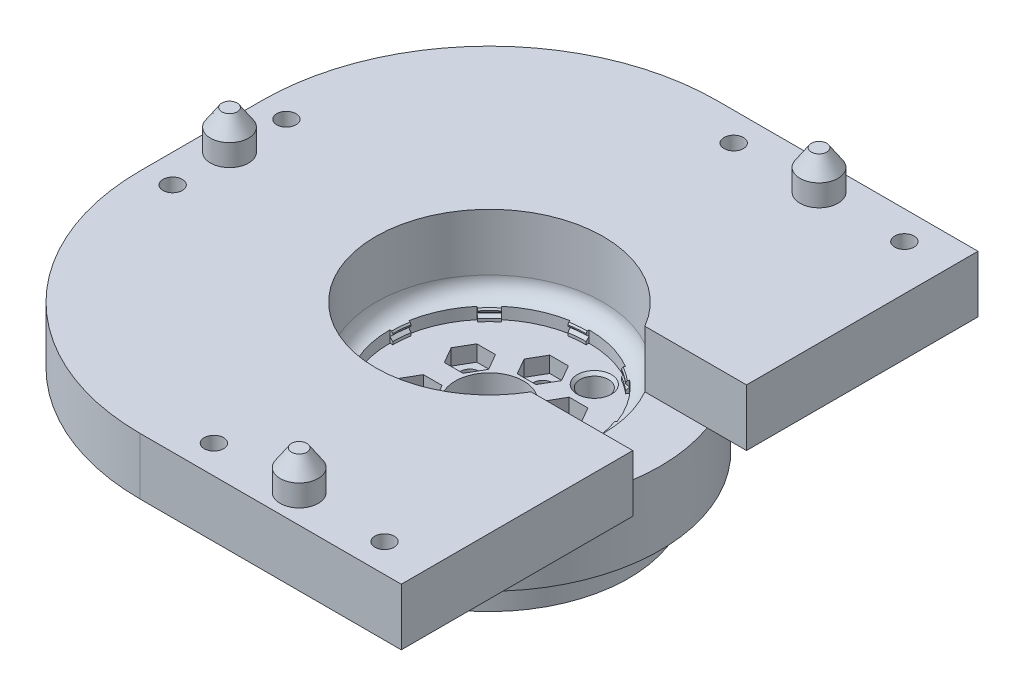
from build123d import *

# Parameters (mm, degrees)
CUT_EXTRUDE1_REACH            = 47
CUT_EXTRUDE1_END_MAJOR_RADIUS = 17
CUT_EXTRUDE1_END_MINOR_RADIUS = 3
CIRPATTERN1_COUNT             = 9
SKETCH3_R                     = 2.5
SKETCH3_R_2                   = 1.7
CUT_EXTRUDE2_DEPTH            = 2.8
SKETCH3_2_R                   = 1.7
CUT_EXTRUDE3_DEPTH            = 46
SKETCH3_4_R                   = 2.5
CUT_EXTRUDE4_DEPTH            = 5
CHAMFER1_SIZE                 = 0.5
CUT_EXTRUDE5_DEPTH            = 10
BOSS_EXTRUDE1_DEPTH           = 10
SKETCH10_R                    = 1.7
CUT_EXTRUDE6_DEPTH            = 78.723741547
CUT_EXTRUDE7_DEPTH            = 3


with BuildPart() as part:
    # Sketch1 → Revolve1 (revolve)
    with BuildSketch(Plane.XY, mode=Mode.PRIVATE) as revolve1_sk:
        with BuildLine():
            Line((6, 15), (6, 0))
            Line((6, 0), (19.8, 0))
            Line((19.8, 0), (19.8, 0.2))
            Line((19.8, 0.2), (24.5, 0.2))
            Line((24.5, 0.2), (24.5, 7.2))
            Line((24.5, 7.2), (30, 7.2))
            Line((30, 7.2), (30, 30))
            Line((30, 30), (20, 30))
            Line((20, 30), (20, 20))
            ThreePointArc((20, 20), (19.19089023, 17.950609847), (17.2, 17.006674091))
            Line((17.2, 17.006674091), (17, 16.7))
            Line((17, 16.7), (17, 16.5))
            Line((17, 16.5), (17.5, 16))
            Line((17.5, 16), (17, 15.5))
            Line((17, 15.5), (17, 15))
            Line((17, 15), (6, 15))
        make_face()
    revolve(revolve1_sk.sketch.rotate(Axis((0, -743.646827703, 0), (0, 1, 0)), 90), axis=Axis((0, -743.646827703, 0), (0, 1, 0)))

    # Cut-Extrude1: up to this torus (the profile starts outside it)
    cut_extrude1_end = Plane(origin=(0, 20, 0), z_dir=(0, -1, 0)) * Torus(CUT_EXTRUDE1_END_MAJOR_RADIUS, CUT_EXTRUDE1_END_MINOR_RADIUS, mode=Mode.PRIVATE)
    # Sketch2 → Cut-Extrude1 (cut, up to the surface)
    with BuildSketch(Plane(origin=(0, 15, 0), x_dir=(1, 0, 0), z_dir=(0, 1, 0)), mode=Mode.PRIVATE) as cut_extrude1_sk1:
        with BuildLine():
            Line((8.5, 14.722431864), (8.75, 15.155444566))
            ThreePointArc((8.75, 15.155444566), (4.529333289, 16.90370196), (0, 17.5))
            Line((0, 17.5), (0, 17))
            ThreePointArc((0, 17), (4.399923767, 16.420739047), (8.5, 14.722431864))
        make_face()
    cut_extrude1_tool1 = extrude(cut_extrude1_sk1.sketch, amount=CUT_EXTRUDE1_REACH, mode=Mode.PRIVATE) - cut_extrude1_end
    cut_extrude1 = cut_extrude1_tool1.solids().sort_by_distance((4.414112, 15, -16.47369))[0]
    add(cut_extrude1, mode=Mode.SUBTRACT)

    # CirPattern1: Cut-Extrude1 ×9 about axis
    cirpattern1_axis = Axis((0, 0, 0), (0, 1, 0))
    for i in range(1, CIRPATTERN1_COUNT):
        add(cut_extrude1.rotate(cirpattern1_axis, i * 360 / CIRPATTERN1_COUNT), mode=Mode.SUBTRACT)

    # Sketch3 → Cut-Extrude2 (cut)
    # profile 1 of 8: a face of its own
    with BuildSketch(Plane(origin=(0, 15, 0), x_dir=(1, 0, 0), z_dir=(0, 1, 0))):
        with Locations(Location((6.75, 11.691342951, 0), (0, 0, 270))):
            Circle(SKETCH3_R)
    # profile 2 of 8: a face of its own
    with BuildSketch(Plane(origin=(0, 15, 0), x_dir=(1, 0, 0), z_dir=(0, 1, 0))):
        with Locations(Location((-6.75, -11.691342951, 0), (0, 0, 270))):
            Circle(SKETCH3_R)
    # profile 3 of 8: a face of its own
    with BuildSketch(Plane(origin=(0, 15, 0), x_dir=(1, 0, 0), z_dir=(0, 1, 0))):
        Polygon((9.773096682, 1.8425), (11.418544949, 4.6925), (9.773096682, 7.5425), (6.482200147, 7.5425), (4.83675188, 4.6925), (6.482200147, 1.8425), align=None)
        with Locations(Location((8.127648415, 4.6925, 0), (0, 0, 270))):
            Circle(SKETCH3_R_2, mode=Mode.SUBTRACT)
    # profile 4 of 8: a face of its own
    with BuildSketch(Plane(origin=(0, 15, 0), x_dir=(1, 0, 0), z_dir=(0, 1, 0))):
        Polygon((3.290896534, 9.385), (1.645448267, 12.235), (-1.645448267, 12.235), (-3.290896534, 9.385), (-1.645448267, 6.535), (1.645448267, 6.535), align=None)
        with Locations(Location((0, 9.385, 0), (0, 0, 270))):
            Circle(SKETCH3_R_2, mode=Mode.SUBTRACT)
    # profile 5 of 8: a face of its own
    with BuildSketch(Plane(origin=(0, 15, 0), x_dir=(1, 0, 0), z_dir=(0, 1, 0))):
        Polygon((6.482200147, -7.5425), (9.773096682, -7.5425), (11.418544949, -4.6925), (9.773096682, -1.8425), (6.482200147, -1.8425), (4.83675188, -4.6925), align=None)
        with Locations(Location((8.127648415, -4.6925, 0), (0, 0, 270))):
            Circle(SKETCH3_R_2, mode=Mode.SUBTRACT)
    # profile 6 of 8: a face of its own
    with BuildSketch(Plane(origin=(0, 15, 0), x_dir=(1, 0, 0), z_dir=(0, 1, 0))):
        Polygon((-3.290896534, -9.385), (-1.645448267, -12.235), (1.645448267, -12.235), (3.290896534, -9.385), (1.645448267, -6.535), (-1.645448267, -6.535), align=None)
        with Locations(Location((0, -9.385, 0), (0, 0, 270))):
            Circle(SKETCH3_R_2, mode=Mode.SUBTRACT)
    # profile 7 of 8: a face of its own
    with BuildSketch(Plane(origin=(0, 15, 0), x_dir=(1, 0, 0), z_dir=(0, 1, 0))):
        Polygon((-9.773096682, -1.8425), (-11.418544949, -4.6925), (-9.773096682, -7.5425), (-6.482200147, -7.5425), (-4.83675188, -4.6925), (-6.482200147, -1.8425), align=None)
        with Locations(Location((-8.127648415, -4.6925, 0), (0, 0, 270))):
            Circle(SKETCH3_R_2, mode=Mode.SUBTRACT)
    # profile 8 of 8: a face of its own
    with BuildSketch(Plane(origin=(0, 15, 0), x_dir=(1, 0, 0), z_dir=(0, 1, 0))):
        Polygon((-6.482200147, 7.5425), (-9.773096682, 7.5425), (-11.418544949, 4.6925), (-9.773096682, 1.8425), (-6.482200147, 1.8425), (-4.83675188, 4.6925), align=None)
        with Locations(Location((-8.127648415, 4.6925, 0), (0, 0, 270))):
            Circle(SKETCH3_R_2, mode=Mode.SUBTRACT)
    extrude(amount=-CUT_EXTRUDE2_DEPTH, mode=Mode.SUBTRACT)

    # Sketch3<2> → Cut-Extrude3 (cut, through all)
    with BuildSketch(Plane(origin=(0, 15, 0), x_dir=(1, 0, 0), z_dir=(0, 1, 0))):
        with Locations(Location((0, 9.385, 0), (0, 0, 270))):
            Circle(SKETCH3_2_R)
        with Locations(Location((8.127648415, 4.6925, 0), (0, 0, 270))):
            Circle(SKETCH3_2_R)
        with Locations(Location((8.127648415, -4.6925, 0), (0, 0, 270))):
            Circle(SKETCH3_2_R)
        with Locations(Location((0, -9.385, 0), (0, 0, 270))):
            Circle(SKETCH3_2_R)
        with Locations(Location((-8.127648415, -4.6925, 0), (0, 0, 270))):
            Circle(SKETCH3_2_R)
        with Locations(Location((-8.127648415, 4.6925, 0), (0, 0, 270))):
            Circle(SKETCH3_2_R)
    extrude(amount=-CUT_EXTRUDE3_DEPTH, mode=Mode.SUBTRACT)

    # Sketch3<4> → Cut-Extrude4 (cut)
    with BuildSketch(Plane(origin=(0, 15, 0), x_dir=(1, 0, 0), z_dir=(0, 1, 0))):
        with Locations(Location((6.75, 11.691342951, 0), (0, 0, 270))):
            Circle(SKETCH3_4_R)
        with Locations(Location((-6.75, -11.691342951, 0), (0, 0, 270))):
            Circle(SKETCH3_4_R)
    extrude(amount=-CUT_EXTRUDE4_DEPTH, mode=Mode.SUBTRACT)

    # Chamfer1
    chamfer1_edges = [part.edges().sort_by_distance(p)[0] for p in [
        (6.75, 15, -14.191342951),
        (-6.75, 15, 9.191342951),
    ]]
    chamfer(chamfer1_edges, length=CHAMFER1_SIZE)

    # Sketch6 → Cut-Extrude5 (cut)
    with BuildSketch(Plane(origin=(0, 30, 0), x_dir=(1, 0, 0), z_dir=(0, 1, 0))):
        with BuildLine():
            Line((28.284271247, 10), (17.320508076, 10))
            ThreePointArc((17.320508076, 10), (19.318516526, 5.176380902), (20, 0))
            ThreePointArc((20, 0), (19.318516526, -5.176380902), (17.320508076, -10))
            Line((17.320508076, -10), (28.284271247, -10))
            ThreePointArc((28.284271247, -10), (29.56795679, -5.073059362), (30, 0))
            ThreePointArc((30, 0), (29.56795679, 5.073059362), (28.284271247, 10))
        make_face()
    extrude(amount=-CUT_EXTRUDE5_DEPTH, mode=Mode.SUBTRACT)

    # Sketch7 → Boss-Extrude1 (add)
    with BuildSketch(Plane(origin=(0, 30, 0), x_dir=(1, 0, 0), z_dir=(0, 1, 0))):
        with BuildLine():
            Line((28.284271247, -10), (17.320508076, -10))
            ThreePointArc((17.320508076, -10), (-20, 0), (17.320508076, 10))
            Line((17.320508076, 10), (28.284271247, 10))
            ThreePointArc((28.284271247, 10), (-30, 0), (28.284271247, -10))
        make_face()
        with BuildLine():
            Line((0, -30.7), (35.2, -30.7))
            Line((35.2, -30.7), (35.2, -10))
            Line((35.2, -10), (28.284271247, -10))
            ThreePointArc((28.284271247, -10), (-30, 0), (28.284271247, 10))
            Line((28.284271247, 10), (35.2, 10))
            Line((35.2, 10), (35.2, 30.7))
            Line((35.2, 30.7), (0, 30.7))
            ThreePointArc((0, 30.7), (-30.7, 0), (0, -30.7))
        make_face()
        with BuildLine():
            Line((35.2, 50.7), (-10.7, 50.7))
            ThreePointArc((-10.7, 50.7), (-38.984271247, 38.984271247), (-50.7, 10.7))
            Line((-50.7, 10.7), (-50.7, -10.7))
            ThreePointArc((-50.7, -10.7), (-38.984271247, -38.984271247), (-10.7, -50.7))
            Line((-10.7, -50.7), (35.2, -50.7))
            Line((35.2, -50.7), (35.2, -30.7))
            Line((35.2, -30.7), (0, -30.7))
            ThreePointArc((0, -30.7), (-30.7, 0), (0, 30.7))
            Line((0, 30.7), (35.2, 30.7))
            Line((35.2, 30.7), (35.2, 50.7))
        make_face()
    extrude(amount=-BOSS_EXTRUDE1_DEPTH)

    # Sketch9 → Revolve2 (revolve)
    with BuildSketch(Plane.XY.offset(45.7)):
        Polygon((15.6, 30), (15.6, 33.8), (13.6, 36.8), (12.25, 36.8), (12.25, 30), align=None)
    revolve2 = revolve(axis=Axis((12.25, -970, 45.7), (0, 1, 0)))

    # Sketch-Pattern1: Revolve2 at 2 more places
    with Locations((-57.95, 0, -45.7), (0, 0, -91.4)):
        add(revolve2)

    # Sketch10 → Cut-Extrude6 (cut, through all)
    with BuildSketch(Plane(origin=(0, 30, 0), x_dir=(1, 0, 0), z_dir=(0, 1, 0))):
        with Locations(Location((27.25, -45.7, 0), (0, 0, 270))):
            Circle(SKETCH10_R)
        with Locations(Location((-2.75, -45.7, 0), (0, 0, 270))):
            Circle(SKETCH10_R)
        with Locations(Location((-45.7, -10, 0), (0, 0, 270))):
            Circle(SKETCH10_R)
        with Locations(Location((-45.7, 10, 0), (0, 0, 270))):
            Circle(SKETCH10_R)
        with Locations(Location((-2.75, 45.7, 0), (0, 0, 270))):
            Circle(SKETCH10_R)
        with Locations(Location((27.25, 45.7, 0), (0, 0, 270))):
            Circle(SKETCH10_R)
    extrude(amount=-CUT_EXTRUDE6_DEPTH, mode=Mode.SUBTRACT)

    # Sketch11 → Cut-Extrude7 (cut)
    with BuildSketch(Plane.XZ.offset(-20)):
        Polygon((30.598631561, 45.7), (28.924315781, 48.6), (25.575684219, 48.6), (23.901368439, 45.7), (25.575684219, 42.8), (28.924315781, 42.8), align=None)
        Polygon((0.598631561, 45.7), (-1.075684219, 48.6), (-4.424315781, 48.6), (-6.098631561, 45.7), (-4.424315781, 42.8), (-1.075684219, 42.8), align=None)
        Polygon((-45.7, 13.348631561), (-48.6, 11.674315781), (-48.6, 8.325684219), (-45.7, 6.651368439), (-42.8, 8.325684219), (-42.8, 11.674315781), align=None)
        Polygon((-42.8, -11.674315781), (-45.7, -13.348631561), (-48.6, -11.674315781), (-48.6, -8.325684219), (-45.7, -6.651368439), (-42.8, -8.325684219), align=None)
        Polygon((-1.075684219, -42.8), (0.598631561, -45.7), (-1.075684219, -48.6), (-4.424315781, -48.6), (-6.098631561, -45.7), (-4.424315781, -42.8), align=None)
        Polygon((28.924315781, -42.8), (30.598631561, -45.7), (28.924315781, -48.6), (25.575684219, -48.6), (23.901368439, -45.7), (25.575684219, -42.8), align=None)
    extrude(amount=-CUT_EXTRUDE7_DEPTH, mode=Mode.SUBTRACT)


solid = part.part
